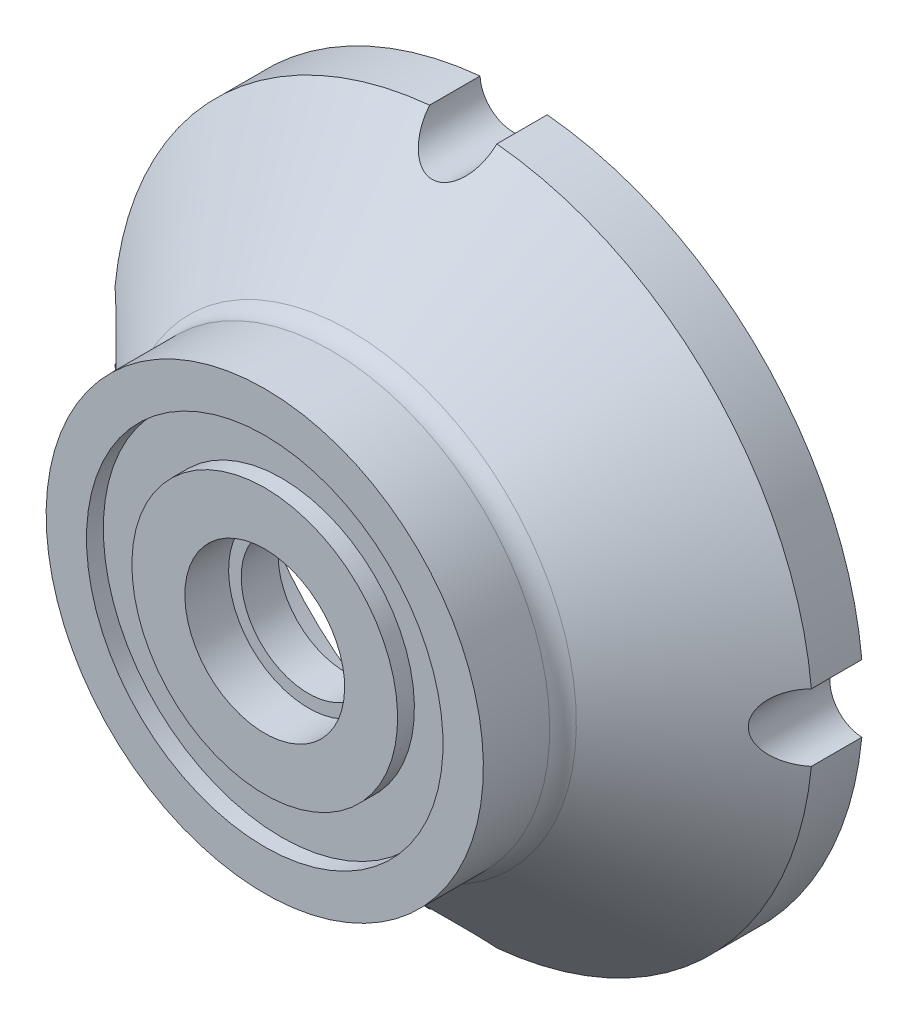
from build123d import *

# Parameters (mm, degrees)
CUT_EXTRUDE1_REACH = 34.929
SKETCH3_R          = 2
FILLET1_R          = 1.5


with BuildPart() as part:
    # Sketch2 → Revolve1 (revolve)
    with BuildSketch(Plane(origin=(0, 0, 0), x_dir=(0, 0, -1), z_dir=(1, 0, 0))):
        Polygon((0, 17), (0, 20.8), (-3, 20.8), (-10.2, 13), (-14.8, 13), (-14.8, 10.6), (-13.8, 10.6), (-13.8, 7.9), (-14.8, 7.9), (-14.8, 4.75), (-12.2, 4.75), (-12.2, 4), (-10, 4), (-10, 11.2), (-4.2, 17), align=None)
    revolve(axis=Axis((0, 0, 0), (0, 0, 1)))

    # Cut-Extrude1: up to this cone (the profile starts inside it)
    cut_extrude1_end = Plane(origin=(0, 0, 0), z_dir=(0, 0, -1)).offset(-22.199999) * Cone(1.083e-06, 88.485583333, 81.678999, align=(Align.CENTER, Align.CENTER, Align.MIN), mode=Mode.PRIVATE)
    # Sketch3 → Cut-Extrude1 (cut, up to the surface)
    with BuildSketch(Plane.XY, mode=Mode.PRIVATE) as cut_extrude1_sk1:
        with Locations((0, 20.8)):
            Circle(SKETCH3_R)
    cut_extrude1_tool1 = extrude(cut_extrude1_sk1.sketch, amount=CUT_EXTRUDE1_REACH, mode=Mode.PRIVATE) & cut_extrude1_end
    add(cut_extrude1_tool1.solids().sort_by_distance((0, 20.8, 0))[0], mode=Mode.SUBTRACT)
    # Sketch3 → Cut-Extrude1 (cut, up to the surface)
    with BuildSketch(Plane.XY, mode=Mode.PRIVATE) as cut_extrude1_sk2:
        with Locations((20.8, 0)):
            Circle(SKETCH3_R)
    cut_extrude1_tool2 = extrude(cut_extrude1_sk2.sketch, amount=CUT_EXTRUDE1_REACH, mode=Mode.PRIVATE) & cut_extrude1_end
    add(cut_extrude1_tool2.solids().sort_by_distance((20.8, 0, 0))[0], mode=Mode.SUBTRACT)
    # Sketch3 → Cut-Extrude1 (cut, up to the surface)
    with BuildSketch(Plane.XY, mode=Mode.PRIVATE) as cut_extrude1_sk3:
        with Locations((0, -20.8)):
            Circle(SKETCH3_R)
    cut_extrude1_tool3 = extrude(cut_extrude1_sk3.sketch, amount=CUT_EXTRUDE1_REACH, mode=Mode.PRIVATE) & cut_extrude1_end
    add(cut_extrude1_tool3.solids().sort_by_distance((0, -20.8, 0))[0], mode=Mode.SUBTRACT)
    # Sketch3 → Cut-Extrude1 (cut, up to the surface)
    with BuildSketch(Plane.XY, mode=Mode.PRIVATE) as cut_extrude1_sk4:
        with Locations((-20.8, 0)):
            Circle(SKETCH3_R)
    cut_extrude1_tool4 = extrude(cut_extrude1_sk4.sketch, amount=CUT_EXTRUDE1_REACH, mode=Mode.PRIVATE) & cut_extrude1_end
    add(cut_extrude1_tool4.solids().sort_by_distance((-20.8, 0, 0))[0], mode=Mode.SUBTRACT)

    # Fillet1
    fillet1_edges = [part.edges().sort_by_distance(p)[0] for p in [
        (0, -13, 10.2),
    ]]
    fillet(fillet1_edges, radius=FILLET1_R)


solid = part.part
